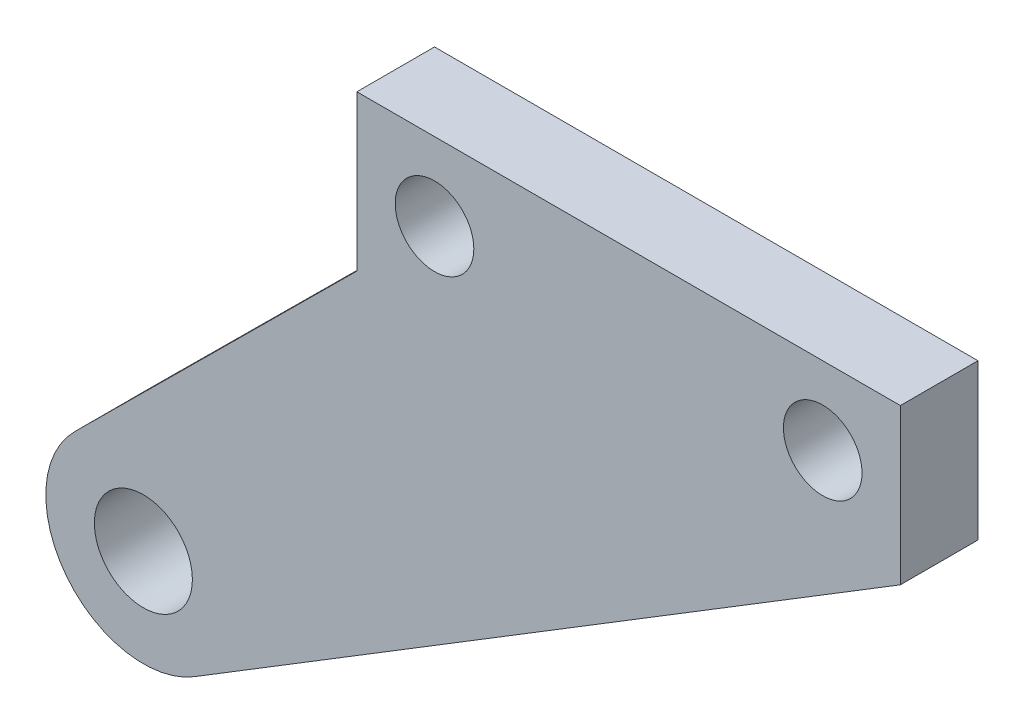
from build123d import *

# Parameters (mm, degrees)
SKETCH_1_R      = 2.025
SKETCH_1_R_2    = 2.525
EXTRUDE_1_DEPTH = 2


with BuildPart() as part:
    # 草图1 → 凸台-拉伸1 (new, symmetric)
    with BuildSketch(Plane.XY):
        with BuildLine():
            Line((-14, 4), (14, 4))
            Line((14, 4), (14, -4))
            Line((14, -4), (-22.374938993, -26.284819682))
            ThreePointArc((-22.374938993, -26.284819682), (-28.952100704, -25.103469836), (-28.540142401, -18.433767144))
            Line((-28.540142401, -18.433767144), (-14, -4))
            Line((-14, -4), (-14, 4))
        make_face()
        with Locations((10, 0)):
            Circle(SKETCH_1_R, mode=Mode.SUBTRACT)
        with Locations((-10, 0)):
            Circle(SKETCH_1_R, mode=Mode.SUBTRACT)
        with Locations((-25, -22)):
            Circle(SKETCH_1_R_2, mode=Mode.SUBTRACT)
    extrude(amount=EXTRUDE_1_DEPTH, both=True)


solid = part.part
